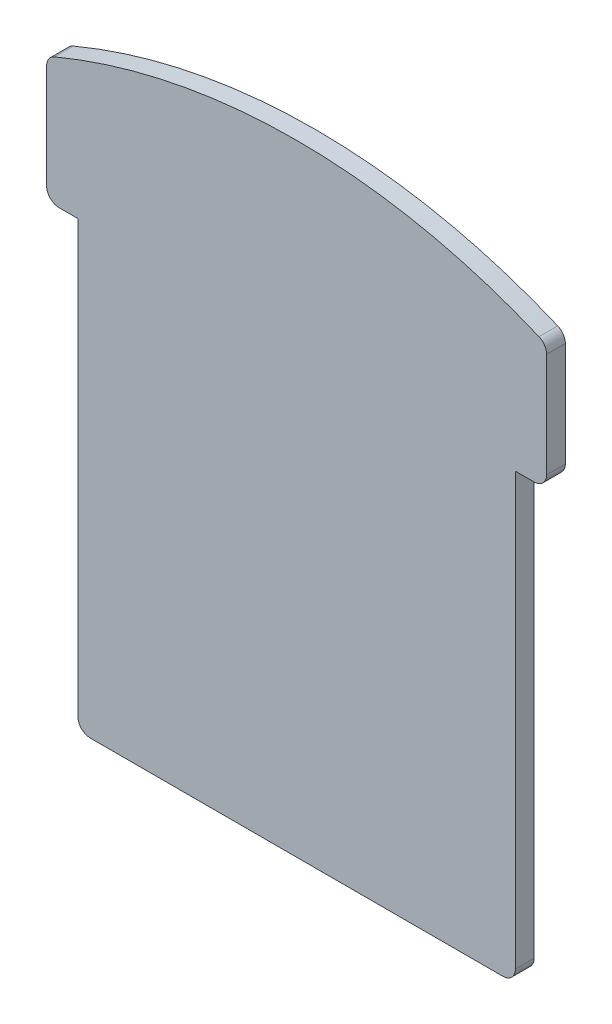
from build123d import *

# Parameters (mm, degrees)
ESQUISSE1_W        = 70
ESQUISSE1_H        = 71
BOSS_EXTRU_1_DEPTH = 3
BOSS_EXTRU_2_DEPTH = 3
CONG_1_R           = 2


with BuildPart() as part:
    # Esquisse1 → Boss.-Extru.1 (new body)
    with BuildSketch(Plane.XY):
        with Locations((35, 35.5)):
            Rectangle(ESQUISSE1_W, ESQUISSE1_H)
    extrude(amount=BOSS_EXTRU_1_DEPTH)

    # Esquisse2 → Boss.-Extru.2 (add)
    with BuildSketch(Plane.XY.offset(3)):
        with BuildLine():
            Line((-5, 91), (-5, 71))
            Line((-5, 71), (75, 71))
            Line((75, 71), (75, 91))
            ThreePointArc((75, 91), (35, 99.348486101), (-5, 91))
        make_face()
    extrude(amount=-BOSS_EXTRU_2_DEPTH)

    # Congé1
    cong_1_edges = [part.edges().sort_by_distance(p)[0] for p in [
        (-5, 91, 1.5),
        (75, 91, 1.5),
        (75, 71, 1.5),
        (-5, 71, 1.5),
        (70, 0, 1.5),
        (0, 0, 1.5),
    ]]
    fillet(cong_1_edges, radius=CONG_1_R)


solid = part.part
